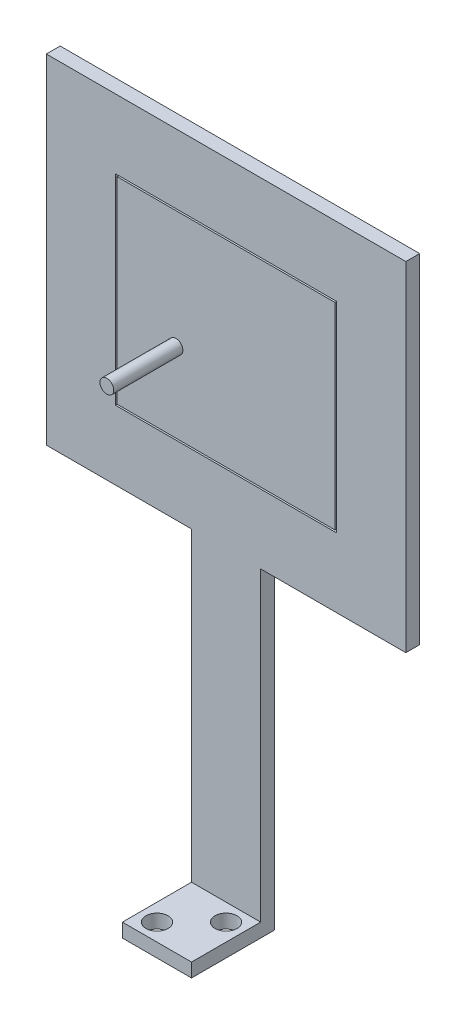
from build123d import *

# Parameters (mm, degrees)
SKETCH1_W           = 31.5
SKETCH1_H           = 28.5
BOSS_EXTRUDE2_DEPTH = 1.5
SKETCH3_R           = 1
BOSS_EXTRUDE3_DEPTH = 10
SKETCH4_W           = 52
SKETCH4_H           = 49
SKETCH4_W_2         = 32
SKETCH4_H_2         = 29
BOSS_EXTRUDE4_DEPTH = 2
SKETCH6_W           = 10
SKETCH6_H           = 2
BOSS_EXTRUDE5_DEPTH = 44.25
SKETCH7_W           = 10
SKETCH7_H           = 12
SKETCH7_R           = 1.6
BOSS_EXTRUDE6_DEPTH = 2


with BuildPart() as part:
    # Sketch1 → Boss-Extrude2 (new body)
    with BuildSketch(Plane.XY):
        with Locations((15.75, -14.25)):
            Rectangle(SKETCH1_W, SKETCH1_H)
    extrude(amount=BOSS_EXTRUDE2_DEPTH)

    # Sketch3 → Boss-Extrude3 (add)
    with BuildSketch(Plane.XY.offset(1.5)):
        with Locations((8.5, -17)):
            Circle(SKETCH3_R)
    extrude(amount=BOSS_EXTRUDE3_DEPTH)


with BuildPart() as body_2:
    # Sketch4 → Boss-Extrude4 (new body)
    with BuildSketch(Plane.XY.offset(1.5)):
        with Locations((15.75, -14.25)):
            Rectangle(SKETCH4_W, SKETCH4_H)
        with Locations((15.75, -14.25)):
            Rectangle(SKETCH4_W_2, SKETCH4_H_2, mode=Mode.SUBTRACT)
    extrude(amount=-BOSS_EXTRUDE4_DEPTH)

    # Sketch6 → Boss-Extrude5 (add)
    with BuildSketch(Plane.XZ.offset(38.75)):
        with Locations((15.75, 0.5)):
            Rectangle(SKETCH6_W, SKETCH6_H)
    extrude(amount=BOSS_EXTRUDE5_DEPTH)

    # Sketch7 → Boss-Extrude6 (add)
    with BuildSketch(Plane.XZ.offset(83)):
        with Locations((15.75, 5.5)):
            Rectangle(SKETCH7_W, SKETCH7_H)
        with Locations(Location((13.253158005, 8.996841995, 0), (0, 0, 270))):
            Circle(SKETCH7_R, mode=Mode.SUBTRACT)
        with Locations(Location((18.246841995, 4.003158005, 0), (0, 0, 270))):
            Circle(SKETCH7_R, mode=Mode.SUBTRACT)
    extrude(amount=BOSS_EXTRUDE6_DEPTH)


solid = Compound([part.part, body_2.part])
